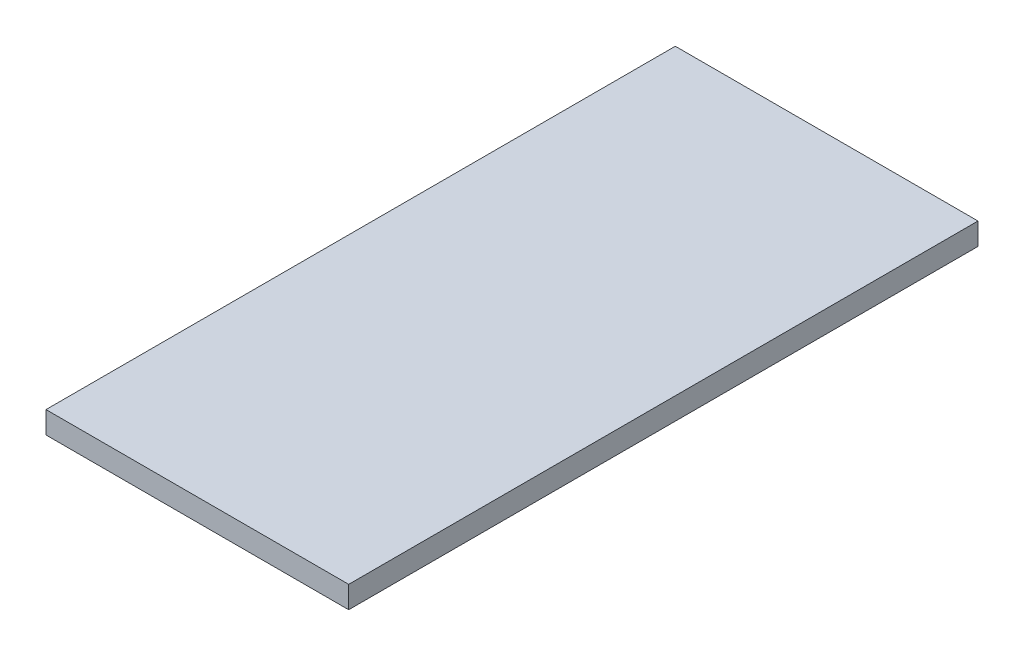
from build123d import *

# Parameters (mm, degrees)
SKETCH_1_W           = 23
SKETCH_1_H           = 80
EXTRUDE_1_DEPTH      = 7
SKETCH_1_5_W         = 19
SKETCH_1_5_H         = 76
CUT_EXTRUDE_2_DEPTH  = 3
SKETCH_2_R           = 0.75
CUT_EXTRUDE_3_DEPTH  = 2
SKETCH_4_W           = 96.2
SKETCH_4_H           = 80
EXTRUDE_2_DEPTH      = 7
SKETCH_5_W           = 29.4
SKETCH_5_H           = 42.4
SKETCH_5_W_2         = 12.4
SKETCH_5_H_2         = 36
CUT_EXTRUDE_4_DEPTH  = 3
SKETCH_6_R           = 0.65
CUT_EXTRUDE_5_DEPTH  = 2
SKETCH_8_W           = 96.2
SKETCH_8_H           = 7
EXTRUDE_3_DEPTH      = 40
SKETCH_15_W          = 27.5
SKETCH_15_H          = 80
SKETCH_15_W_2        = 45.7
EXTRUDE_4_DEPTH      = 7
SKETCH_9_W           = 58.2
SKETCH_9_H           = 36.2
CUT_EXTRUDE_6_DEPTH  = 1
SKETCH_10_W          = 1.7
SKETCH_10_H          = 26.6
SKETCH_10_W_2        = 5.2
SKETCH_10_H_2        = 25
SKETCH_10_W_3        = 8.1
SKETCH_10_H_3        = 28.2
SKETCH_10_W_4        = 3.1
SKETCH_10_H_4        = 20.2
CUT_EXTRUDE_7_DEPTH  = 2
SKETCH_11_R          = 0.65
CUT_EXTRUDE_8_DEPTH  = 2
SKETCH_12_W          = 16.4
SKETCH_12_H          = 30.2
CUT_EXTRUDE_9_DEPTH  = 1.7
SKETCH_13_W          = 19
SKETCH_13_H          = 32.2
CUT_EXTRUDE_10_DEPTH = 4.4
SKETCH_14_W          = 16.3
SKETCH_14_H          = 25.3
CUT_EXTRUDE_11_DEPTH = 1.7
SKETCH_16_W          = 10
SKETCH_16_H          = 4
SKETCH_16_W_2        = 6.1
SKETCH_16_W_3        = 13
SKETCH_16_H_2        = 32.2
SKETCH_16_W_4        = 10.4
SKETCH_16_H_3        = 30.2
SKETCH_16_H_4        = 3.6
SKETCH_16_W_5        = 42.4
SKETCH_16_H_5        = 20.2
CUT_EXTRUDE_12_DEPTH = 6
SKETCH_17_R          = 0.65
CUT_EXTRUDE_13_DEPTH = 3


with BuildPart() as part:
    # 草图1 → 凸台-拉伸1 (new body)
    with BuildSketch(Plane(origin=(0, 0, 0), x_dir=(1, 0, 0), z_dir=(0, 1, 0))):
        Rectangle(SKETCH_1_W, SKETCH_1_H)
    extrude(amount=EXTRUDE_1_DEPTH)

    # 草图1<5> → 切除-拉伸2 (cut)
    with BuildSketch(Plane(origin=(0, 0, 0), x_dir=(1, 0, 0), z_dir=(0, 1, 0))):
        Rectangle(SKETCH_1_5_W, SKETCH_1_5_H)
    extrude(amount=CUT_EXTRUDE_2_DEPTH, mode=Mode.SUBTRACT)

    # 草图2 → 切除-拉伸3 (cut)
    with BuildSketch(Plane.XZ.offset(-3)):
        with Locations(Location((-6, 34.580239709, 0), (0, 0, 270))):
            Circle(SKETCH_2_R)
        with Locations(Location((6, 34.580239709, 0), (0, 0, 270))):
            Circle(SKETCH_2_R)
        with Locations(Location((6, 18.580239709, 0), (0, 0, 270))):
            Circle(SKETCH_2_R)
        with Locations(Location((-6, 18.580239709, 0), (0, 0, 270))):
            Circle(SKETCH_2_R)
        with Locations(Location((-6, 8, 0), (0, 0, 270))):
            Circle(SKETCH_2_R)
        with Locations(Location((6, 8, 0), (0, 0, 270))):
            Circle(SKETCH_2_R)
        with Locations(Location((6, -8, 0), (0, 0, 270))):
            Circle(SKETCH_2_R)
        with Locations(Location((-6, -8, 0), (0, 0, 270))):
            Circle(SKETCH_2_R)
        with Locations(Location((-6, -18.580239709, 0), (0, 0, 270))):
            Circle(SKETCH_2_R)
        with Locations(Location((6, -18.580239709, 0), (0, 0, 270))):
            Circle(SKETCH_2_R)
        with Locations(Location((6, -34.580239709, 0), (0, 0, 270))):
            Circle(SKETCH_2_R)
        with Locations(Location((-6, -34.580239709, 0), (0, 0, 270))):
            Circle(SKETCH_2_R)
    extrude(amount=-CUT_EXTRUDE_3_DEPTH, mode=Mode.SUBTRACT)

    # 草图4 → 凸台-拉伸2 (add)
    with BuildSketch(Plane(origin=(0, 7, 0), x_dir=(1, 0, 0), z_dir=(0, 1, 0))):
        with Locations((9.1, 80)):
            Rectangle(SKETCH_4_W, SKETCH_4_H)
    extrude(amount=-EXTRUDE_2_DEPTH)

    # 草图5 → 切除-拉伸4 (cut)
    with BuildSketch(Plane.XZ):
        with Locations((-21.1, -97)):
            Rectangle(SKETCH_5_W, SKETCH_5_H)
        with Locations((49.2, -97)):
            Rectangle(SKETCH_5_W_2, SKETCH_5_H_2)
    extrude(amount=-CUT_EXTRUDE_4_DEPTH, mode=Mode.SUBTRACT)

    # 草图6 → 切除-拉伸5 (cut)
    with BuildSketch(Plane.XZ.offset(-3)):
        with Locations(Location((-31.1, -78.5, 0), (0, 0, 270))):
            Circle(SKETCH_6_R)
        with Locations(Location((-16.1, -78.5, 0), (0, 0, 270))):
            Circle(SKETCH_6_R)
        with Locations(Location((-31.1, -115.5, 0), (0, 0, 270))):
            Circle(SKETCH_6_R)
        with Locations(Location((-16.1, -115.5, 0), (0, 0, 270))):
            Circle(SKETCH_6_R)
        with Locations(Location((49.2, -112.273257218, 0), (0, 0, 270))):
            Circle(SKETCH_6_R)
        with Locations(Location((46.2, -97, 0), (0, 0, 270))):
            Circle(SKETCH_6_R)
        with Locations(Location((49.2, -81.726742782, 0), (0, 0, 270))):
            Circle(SKETCH_6_R)
        with Locations(Location((-9.1, -110.5, 0), (0, 0, 270))):
            Circle(SKETCH_6_R)
        with Locations(Location((-9.1, -83.5, 0), (0, 0, 270))):
            Circle(SKETCH_6_R)
    extrude(amount=-CUT_EXTRUDE_5_DEPTH, mode=Mode.SUBTRACT)

    # 草图8 → 凸台-拉伸3 (add)
    with BuildSketch(Plane(origin=(0, 0, -120), x_dir=(-1, 0, 0), z_dir=(0, 0, -1))):
        with Locations((-9.1, 3.5)):
            Rectangle(SKETCH_8_W, SKETCH_8_H)
    extrude(amount=EXTRUDE_3_DEPTH)

    # 草图15 → 凸台-拉伸4 (add, through all)
    with BuildSketch(Plane.XZ):
        with Locations((-25.25, 0)):
            Rectangle(SKETCH_15_W, SKETCH_15_H)
        with Locations((34.35, 0)):
            Rectangle(SKETCH_15_W_2, SKETCH_15_H)
    extrude(amount=-EXTRUDE_4_DEPTH)

    # 草图9 → 切除-拉伸6 (cut)
    with BuildSketch(Plane.XZ):
        with Locations((26.3, -139.9)):
            Rectangle(SKETCH_9_W, SKETCH_9_H)
    extrude(amount=-CUT_EXTRUDE_6_DEPTH, mode=Mode.SUBTRACT)

    # 草图10 → 切除-拉伸7 (cut)
    with BuildSketch(Plane.XZ.offset(-1)):
        with Locations((16.55, -139.9)):
            Rectangle(SKETCH_10_W, SKETCH_10_H)
        with Locations((30.6, -139.9)):
            Rectangle(SKETCH_10_W_2, SKETCH_10_H_2)
        with Locations((43.45, -139.9)):
            Rectangle(SKETCH_10_W_3, SKETCH_10_H_3)
        with Locations((53.85, -139.9)):
            Rectangle(SKETCH_10_W_4, SKETCH_10_H_4)
    extrude(amount=-CUT_EXTRUDE_7_DEPTH, mode=Mode.SUBTRACT)

    # 草图11 → 切除-拉伸8 (cut)
    with BuildSketch(Plane.XZ.offset(-1)):
        with Locations(Location((0.3, -124.9, 0), (0, 0, 270))):
            Circle(SKETCH_11_R)
        with Locations(Location((0.3, -154.9, 0), (0, 0, 270))):
            Circle(SKETCH_11_R)
        with Locations(Location((52.3, -154.9, 0), (0, 0, 270))):
            Circle(SKETCH_11_R)
        with Locations(Location((52.3, -124.9, 0), (0, 0, 270))):
            Circle(SKETCH_11_R)
    extrude(amount=-CUT_EXTRUDE_8_DEPTH, mode=Mode.SUBTRACT)

    # 草图12 → 切除-拉伸9 (cut)
    with BuildSketch(Plane.XZ):
        with Locations((7.8, -103.1)):
            Rectangle(SKETCH_12_W, SKETCH_12_H)
    extrude(amount=-CUT_EXTRUDE_9_DEPTH, mode=Mode.SUBTRACT)

    # 草图13 → 切除-拉伸10 (cut)
    with BuildSketch(Plane.XZ):
        with Locations((29.5, -102.1)):
            Rectangle(SKETCH_13_W, SKETCH_13_H)
    extrude(amount=-CUT_EXTRUDE_10_DEPTH, mode=Mode.SUBTRACT)

    # 草图14 → 切除-拉伸11 (cut)
    with BuildSketch(Plane.XZ):
        with Locations((47.25, -60.35)):
            Rectangle(SKETCH_14_W, SKETCH_14_H)
    extrude(amount=-CUT_EXTRUDE_11_DEPTH, mode=Mode.SUBTRACT)

    # 草图16 → 切除-拉伸12 (cut)
    with BuildSketch(Plane.XZ):
        Polygon((2.6, -74), (2.6, -88), (13, -88), (13, -78), (13, -74), align=None)
        with Locations((18, -76)):
            Rectangle(SKETCH_16_W, SKETCH_16_H)
        Polygon((23, -74), (23, -78), (23, -86), (36, -86), (36, -78), (36, -74), align=None)
        with Locations((39.05, -76)):
            Rectangle(SKETCH_16_W_2, SKETCH_16_H)
        Polygon((42.1, -73), (42.1, -74), (42.1, -78), (52.4, -78), (52.4, -73), align=None)
        with Locations((29.5, -102.1)):
            Rectangle(SKETCH_16_W_3, SKETCH_16_H_2)
        with Locations((7.8, -103.1)):
            Rectangle(SKETCH_16_W_4, SKETCH_16_H_3)
        with Locations((7.8, -120)):
            Rectangle(SKETCH_16_W_4, SKETCH_16_H_4)
        with Locations((29.5, -120)):
            Rectangle(SKETCH_16_W_3, SKETCH_16_H_4)
        Polygon((13, -121.8), (2.6, -121.8), (2.6, -158), (13, -158), (13, -150), (13, -129.8), align=None)
        with Locations((34.2, -139.9)):
            Rectangle(SKETCH_16_W_5, SKETCH_16_H_5)
    extrude(amount=-CUT_EXTRUDE_12_DEPTH, mode=Mode.SUBTRACT)

    # 草图17 → 切除-拉伸13 (cut)
    with BuildSketch(Plane.XZ):
        with Locations(Location((-3.4, -117.2, 0), (0, 0, 270))):
            Circle(SKETCH_17_R)
        with Locations(Location((41, -117.2, 0), (0, 0, 270))):
            Circle(SKETCH_17_R)
        with Locations(Location((-0.4, -85, 0), (0, 0, 270))):
            Circle(SKETCH_17_R)
        with Locations(Location((5.6, -71, 0), (0, 0, 270))):
            Circle(SKETCH_17_R)
        with Locations(Location((36.1, -71, 0), (0, 0, 270))):
            Circle(SKETCH_17_R)
        with Locations(Location((18, -82, 0), (0, 0, 270))):
            Circle(SKETCH_17_R)
        with Locations(Location((39.5, -82, 0), (0, 0, 270))):
            Circle(SKETCH_17_R)
        with Locations(Location((54.8, -76, 0), (0, 0, 270))):
            Circle(SKETCH_17_R)
    extrude(amount=-CUT_EXTRUDE_13_DEPTH, mode=Mode.SUBTRACT)


solid = part.part
